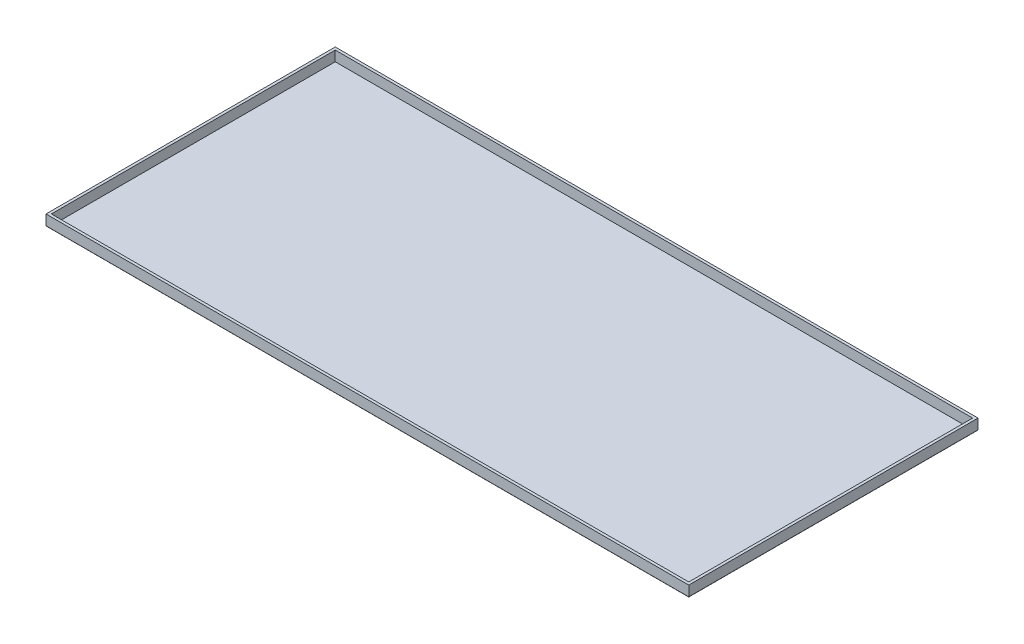
from build123d import *

# Parameters (mm, degrees)
SKETCH2_W           = 600
SKETCH2_H           = 270
SKETCH2_W_2         = 595
SKETCH2_H_2         = 265
BOSS_EXTRUDE2_DEPTH = 10
SKETCH3_W           = 595
SKETCH3_H           = 265
BOSS_EXTRUDE3_DEPTH = 0.5
FILLET1_R           = 0.5


with BuildPart() as part:
    # Sketch2 → Boss-Extrude2 (new body)
    with BuildSketch(Plane(origin=(0, 0, 0), x_dir=(1, 0, 0), z_dir=(0, 1, 0))):
        Rectangle(SKETCH2_W, SKETCH2_H)
        Rectangle(SKETCH2_W_2, SKETCH2_H_2, mode=Mode.SUBTRACT)
    extrude(amount=BOSS_EXTRUDE2_DEPTH)

    # Sketch3 → Boss-Extrude3 (add)
    with BuildSketch(Plane(origin=(0, 0, 0), x_dir=(1, 0, 0), z_dir=(0, 1, 0))):
        Rectangle(SKETCH3_W, SKETCH3_H)
    extrude(amount=BOSS_EXTRUDE3_DEPTH)

    # Fillet1
    fillet1_edges = [part.edges().sort_by_distance(p)[0] for p in [
        (0, 0, -135),
        (300, 0, 0),
        (0, 0, 135),
        (-300, 0, 0),
    ]]
    fillet(fillet1_edges, radius=FILLET1_R)


solid = part.part
